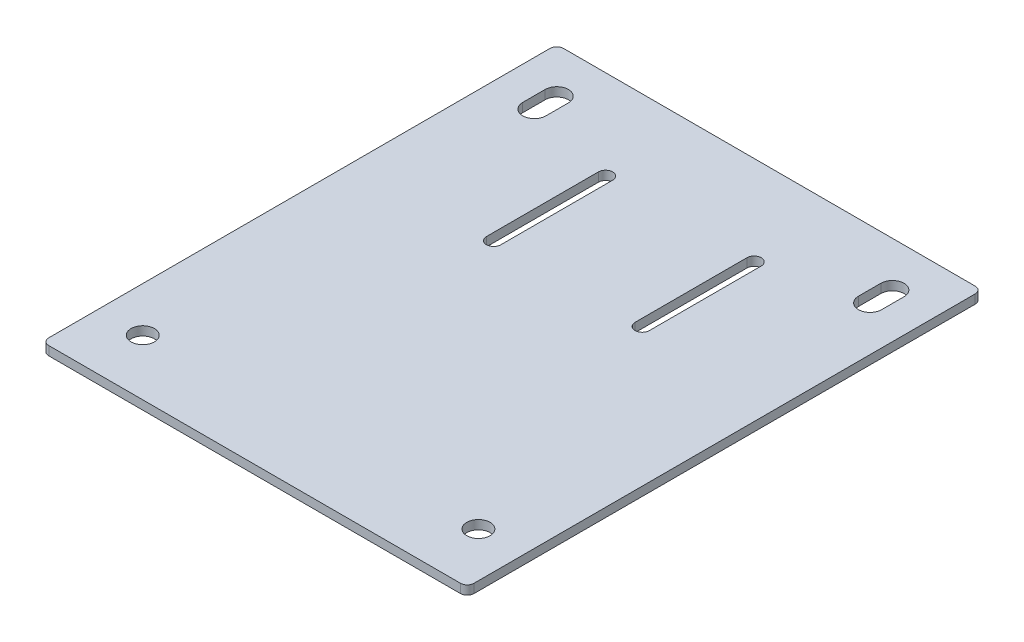
from build123d import *

# Parameters (mm, degrees)
SKETCH1_W           = 95
SKETCH1_H           = 115
SKETCH1_R           = 2.6
BOSS_EXTRUDE1_DEPTH = 2
CUT_EXTRUDE1_DEPTH  = 75.608980693
FILLET1_R           = 1.5
CUT_EXTRUDE2_DEPTH  = 75.608980693


with BuildPart() as part:
    # Sketch1 → Boss-Extrude1 (new body)
    with BuildSketch(Plane(origin=(0, 0, 0), x_dir=(1, 0, 0), z_dir=(0, 1, 0))):
        Rectangle(SKETCH1_W, SKETCH1_H)
        with Locations(Location((-37.5, 45, 0), (0, 0, 270))):
            Circle(SKETCH1_R, mode=Mode.SUBTRACT)
        with Locations(Location((37.5, 45, 0), (0, 0, 90))):
            Circle(SKETCH1_R, mode=Mode.SUBTRACT)
        with Locations(Location((37.5, -45, 0), (0, 0, 270))):
            Circle(SKETCH1_R, mode=Mode.SUBTRACT)
        with Locations(Location((-37.5, -45, 0), (0, 0, 90))):
            Circle(SKETCH1_R, mode=Mode.SUBTRACT)
    extrude(amount=BOSS_EXTRUDE1_DEPTH)

    # Sketch2 → Cut-Extrude1 (cut, through all)
    with BuildSketch(Plane(origin=(0, 2, 0), x_dir=(1, 0, 0), z_dir=(0, 1, 0))):
        with BuildLine():
            Line((-34.9, 47.5), (-34.9, 42.5))
            ThreePointArc((-34.9, 42.5), (-37.5, 39.9), (-40.1, 42.5))
            Line((-40.1, 42.5), (-40.1, 47.5))
            ThreePointArc((-40.1, 47.5), (-37.5, 50.1), (-34.9, 47.5))
        make_face()
        with BuildLine():
            Line((34.9, 47.5), (34.9, 42.5))
            ThreePointArc((34.9, 42.5), (37.5, 39.9), (40.1, 42.5))
            Line((40.1, 42.5), (40.1, 47.5))
            ThreePointArc((40.1, 47.5), (37.5, 50.1), (34.9, 47.5))
        make_face()
    extrude(amount=-CUT_EXTRUDE1_DEPTH, mode=Mode.SUBTRACT)

    # Fillet1
    fillet1_edges = [part.edges().sort_by_distance(p)[0] for p in [
        (47.5, 1, 57.5),
        (-47.5, 1, 57.5),
        (-47.5, 1, -57.5),
        (47.5, 1, -57.5),
    ]]
    fillet(fillet1_edges, radius=FILLET1_R)

    # Sketch3 → Cut-Extrude2 (cut, through all)
    with BuildSketch(Plane.XZ):
        with BuildLine():
            Line((15, -37.5), (15, -12.5))
            ThreePointArc((15, -12.5), (16.6, -10.9), (18.2, -12.5))
            Line((18.2, -12.5), (18.2, -37.5))
            ThreePointArc((18.2, -37.5), (16.6, -39.1), (15, -37.5))
        make_face()
        with BuildLine():
            Line((-15, -37.5), (-15, -12.5))
            ThreePointArc((-15, -12.5), (-16.6, -10.9), (-18.2, -12.5))
            Line((-18.2, -12.5), (-18.2, -37.5))
            ThreePointArc((-18.2, -37.5), (-16.6, -39.1), (-15, -37.5))
        make_face()
    extrude(amount=-CUT_EXTRUDE2_DEPTH, mode=Mode.SUBTRACT)


solid = part.part
